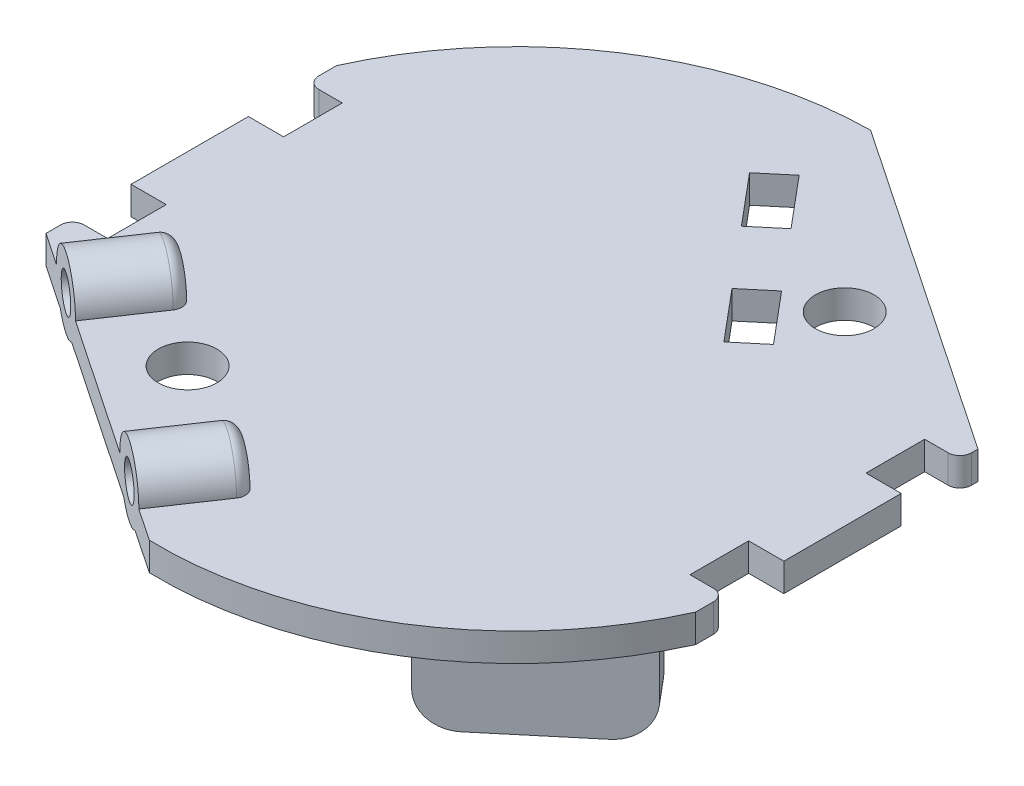
from build123d import *

# Parameters (mm, degrees)
CROQUIS1_R              = 30.5
SALIENTE_EXTRUIR1_DEPTH = 2.4
CORTAR_EXTRUIR3_START   = -4
CORTAR_EXTRUIR3_DEPTH   = 4
CORTAR_EXTRUIR6_DEPTH   = 10
CROQUIS10_R             = 2.5
CORTAR_EXTRUIR7_DEPTH   = 10
CORTAR_EXTRUIR8_START   = -3
CORTAR_EXTRUIR8_DEPTH   = 3
SALIENTE_EXTRUIR2_DEPTH = 10
REDONDEO1_R             = 3
REDONDEO2_R             = 1
CORTAR_EXTRUIR9_START   = -3
CORTAR_EXTRUIR9_DEPTH   = 3
CORTAR_EXTRUIR10_START  = -10
CORTAR_EXTRUIR10_DEPTH  = 10
CROQUIS19_R             = 3
SALIENTE_EXTRUIR5_DEPTH = 7
CROQUIS20_R             = 1.5
CORTAR_EXTRUIR12_DEPTH  = 6
REDONDEO3_R             = 1
REDONDEO4_R             = 1
CORTAR_EXTRUIR13_DEPTH  = 3


with BuildPart() as part:
    # Croquis1 → Saliente-Extruir1 (new body)
    with BuildSketch(Plane(origin=(0, 0, 0), x_dir=(1, 0, 0), z_dir=(0, 1, 0))):
        with Locations(Location((0, 0, 0), (0, 0, 270))):
            Circle(CROQUIS1_R)
    extrude(amount=SALIENTE_EXTRUIR1_DEPTH)

    # Croquis5 → Cortar-Extruir3 (cut)
    with BuildSketch(Plane(origin=(0, 2.4, 0), x_dir=(1, 0, 0), z_dir=(0, 1, 0)).offset(CORTAR_EXTRUIR3_START)):
        with BuildLine():
            Line((28.814059068, 5), (30.087372767, 5))
            ThreePointArc((30.087372767, 5), (29.556634924, 7.526973624), (28.814059068, 10))
            Line((28.814059068, 10), (24.814059068, 10))
            Line((24.814059068, 10), (24.814059068, 5))
            Line((24.814059068, 5), (28.814059068, 5))
        make_face()
        with BuildLine():
            Line((30.087372767, -5), (28.814059068, -5))
            Line((28.814059068, -5), (24.814059068, -5))
            Line((24.814059068, -5), (24.814059068, -10))
            Line((24.814059068, -10), (28.814059068, -10))
            ThreePointArc((28.814059068, -10), (29.556634924, -7.526973624), (30.087372767, -5))
        make_face()
        with BuildLine():
            Line((-24.814059068, 5), (-24.814059068, 10))
            Line((-24.814059068, 10), (-28.814059068, 10))
            ThreePointArc((-28.814059068, 10), (-29.556634924, 7.526973624), (-30.087372767, 5))
            Line((-30.087372767, 5), (-28.814059068, 5))
            Line((-28.814059068, 5), (-24.814059068, 5))
        make_face()
        with BuildLine():
            Line((-28.814059068, -10), (-24.814059068, -10))
            Line((-24.814059068, -10), (-24.814059068, -5))
            Line((-24.814059068, -5), (-28.814059068, -5))
            Line((-28.814059068, -5), (-30.087372767, -5))
            ThreePointArc((-30.087372767, -5), (-29.556634924, -7.526973624), (-28.814059068, -10))
        make_face()
    extrude(amount=CORTAR_EXTRUIR3_DEPTH, mode=Mode.SUBTRACT)

    # Croquis9 → Cortar-Extruir6 (cut)
    with BuildSketch(Plane(origin=(0, 2.4, 0), x_dir=(1, 0, 0), z_dir=(0, 1, 0))):
        Polygon((5.673284852, 12.685390231), (8.887222901, 8.855168016), (11.18535623, 10.783530845), (7.971418181, 14.613753061), align=None)
        Polygon((-2.120514915, 21.973679104), (1.093423133, 18.143456889), (3.391556462, 20.071819718), (0.177618414, 23.902041933), align=None)
    extrude(amount=-CORTAR_EXTRUIR6_DEPTH, mode=Mode.SUBTRACT)

    # Croquis10 → Cortar-Extruir7 (cut)
    with BuildSketch(Plane(origin=(0, 2.4, 0), x_dir=(1, 0, 0), z_dir=(0, 1, 0))):
        with Locations(Location((12, 16, 0), (0, 0, 270))):
            Circle(CROQUIS10_R)
        with Locations(Location((-12, -16, 0), (0, 0, 270))):
            Circle(CROQUIS10_R)
    extrude(amount=-CORTAR_EXTRUIR7_DEPTH, mode=Mode.SUBTRACT)

    # Croquis11 → Cortar-Extruir8 (cut)
    with BuildSketch(Plane(origin=(0, 2.4, 0), x_dir=(1, 0, 0), z_dir=(0, 1, 0)).offset(CORTAR_EXTRUIR8_START)):
        with BuildLine():
            ThreePointArc((-28.814059068, -10), (-28.341972277, -11.268655974), (-27.814059068, -12.515115586))
            Line((-27.814059068, -12.515115586), (-27.814059068, -10))
            Line((-27.814059068, -10), (-28.814059068, -10))
        make_face()
        with BuildLine():
            Line((-27.814059068, -5), (-27.814059068, 5))
            Line((-27.814059068, 5), (-30.087372767, 5))
            ThreePointArc((-30.087372767, 5), (-30.5, 0), (-30.087372767, -5))
            Line((-30.087372767, -5), (-27.814059068, -5))
        make_face()
        with BuildLine():
            Line((-27.814059068, 10), (-27.814059068, 12.515115586))
            ThreePointArc((-27.814059068, 12.515115586), (-28.341972277, 11.268655974), (-28.814059068, 10))
            Line((-28.814059068, 10), (-27.814059068, 10))
        make_face()
        with BuildLine():
            Line((28.814059068, -10), (27.814059068, -10))
            Line((27.814059068, -10), (27.814059068, -12.515115586))
            ThreePointArc((27.814059068, -12.515115586), (28.341972277, -11.268655974), (28.814059068, -10))
        make_face()
        with BuildLine():
            Line((30.087372767, 5), (27.814059068, 5))
            Line((27.814059068, 5), (27.814059068, -5))
            Line((27.814059068, -5), (30.087372767, -5))
            ThreePointArc((30.087372767, -5), (30.5, 0), (30.087372767, 5))
        make_face()
        with BuildLine():
            Line((27.814059068, 12.515115586), (27.814059068, 10))
            Line((27.814059068, 10), (28.814059068, 10))
            ThreePointArc((28.814059068, 10), (28.341972277, 11.268655974), (27.814059068, 12.515115586))
        make_face()
    extrude(amount=CORTAR_EXTRUIR8_DEPTH, mode=Mode.SUBTRACT)

    # Croquis13 → Saliente-Extruir2 (add)
    with BuildSketch(Plane.XZ):
        Polygon((-6.816688183, 4.321977983), (-19.672440377, -10.99891088), (-17.374307048, -12.927273709), (-4.518554854, 2.393615154), align=None)
        Polygon((21.527275636, 8.931176939), (23.455638465, 11.229310268), (11.964971818, 20.871124414), (10.036608989, 18.572991084), align=None)
    extrude(amount=SALIENTE_EXTRUIR2_DEPTH)

    # Redondeo1
    redondeo1_edges = [part.edges().sort_by_distance(p)[0] for p in [
        (-5.667621519, -10, 3.357796568),
        (-18.523373712, -10, -11.963092294),
        (22.49145705, -10, 10.080243604),
        (11.000790403, -10, 19.722057749),
    ]]
    fillet(redondeo1_edges, radius=REDONDEO1_R)

    # Redondeo2
    redondeo2_edges = [part.edges().sort_by_distance(p)[0] for p in [
        (-5.667621519, 0, 3.357796568),
        (-13.24456428, 0, -3.338466449),
        (-18.523373712, 0, -11.963092294),
        (22.49145705, 0, 10.080243604),
        (17.710305141, 0, 16.050217341),
        (11.000790403, 0, 19.722057749),
    ]]
    fillet(redondeo2_edges, radius=REDONDEO2_R)

    # Croquis14 → Cortar-Extruir9 (cut)
    with BuildSketch(Plane(origin=(0, 2.4, 0), x_dir=(1, 0, 0), z_dir=(0, 1, 0)).offset(CORTAR_EXTRUIR9_START)):
        with BuildLine():
            Line((-0.28585192, 30.498660441), (27.814059068, 11.545031156))
            Line((27.814059068, 11.545031156), (27.814059068, 12.515115586))
            ThreePointArc((27.814059068, 12.515115586), (16.440879495, 25.689442995), (-0.28585192, 30.498660441))
        make_face()
    extrude(amount=CORTAR_EXTRUIR9_DEPTH, mode=Mode.SUBTRACT)

    # Croquis15 → Cortar-Extruir10 (cut)
    with BuildSketch(Plane(origin=(0, 2.4, 0), x_dir=(1, 0, 0), z_dir=(0, 1, 0)).offset(CORTAR_EXTRUIR10_START)):
        with BuildLine():
            Line((-27.814059068, -12.24829445), (-27.814059068, -12.515115586))
            ThreePointArc((-27.814059068, -12.515115586), (-16.882746118, -25.401237834), (-0.769174213, -30.490299622))
            Line((-0.769174213, -30.490299622), (-27.814059068, -12.24829445))
        make_face()
    extrude(amount=CORTAR_EXTRUIR10_DEPTH, mode=Mode.SUBTRACT)

    # Croquis19 → Saliente-Extruir5 (add)
    with BuildSketch(Plane(origin=(-14.375575006, 0, 21.312666404), x_dir=(0.8290375725550415, 0, 0.5591929034707471), z_dir=(-0.5591929034707471, 0, 0.8290375725550415))):
        with Locations((10.101272087, 2.4)):
            Circle(CROQUIS19_R)
        with Locations((-9.898727913, 2.4)):
            Circle(CROQUIS19_R)
    extrude(amount=-SALIENTE_EXTRUIR5_DEPTH)

    # Croquis20 → Cortar-Extruir12 (cut)
    with BuildSketch(Plane(origin=(-14.375575006, 0, 21.312666404), x_dir=(0.8290375725550415, 0, 0.5591929034707471), z_dir=(-0.5591929034707471, 0, 0.8290375725550415))):
        with Locations((10.101272087, 2.4)):
            Circle(CROQUIS20_R)
        with Locations((-9.898727913, 2.4)):
            Circle(CROQUIS20_R)
    extrude(amount=-CORTAR_EXTRUIR12_DEPTH, mode=Mode.SUBTRACT)

    # Redondeo3
    redondeo3_edges = [part.edges().sort_by_distance(p)[0] for p in [
        (-2.086890591, 5.4, 21.157963063),
        (-18.667642042, 5.4, 9.974104993),
    ]]
    fillet(redondeo3_edges, radius=REDONDEO3_R)

    # Redondeo4
    redondeo4_edges = [part.edges().sort_by_distance(p)[0] for p in [
        (-27.814059068, 1.2, 10),
        (-27.814059068, 1.2, -10),
        (27.814059068, 1.2, 10),
        (27.814059068, 1.2, -10),
    ]]
    fillet(redondeo4_edges, radius=REDONDEO4_R)

    # Croquis21 → Cortar-Extruir13 (cut)
    with BuildSketch(Plane(origin=(0, 2.4, 0), x_dir=(1, 0, 0), z_dir=(0, 1, 0))):
        Polygon((5.673284852, 12.685390231), (7.971418181, 14.613753061), (7.778581899, 14.843566393), (5.480448569, 12.915203564), align=None)
        Polygon((3.391556462, 20.071819718), (1.093423133, 18.143456889), (1.286259416, 17.913643556), (3.584392745, 19.842006385), align=None)
        Polygon((0.177618414, 23.902041933), (-2.120514915, 21.973679104), (-2.313351198, 22.203492437), (-0.015217869, 24.131855266), align=None)
        Polygon((8.887222901, 8.855168016), (11.18535623, 10.783530845), (11.378192513, 10.553717512), (9.080059183, 8.625354683), align=None)
    extrude(amount=-CORTAR_EXTRUIR13_DEPTH, mode=Mode.SUBTRACT)


solid = part.part
